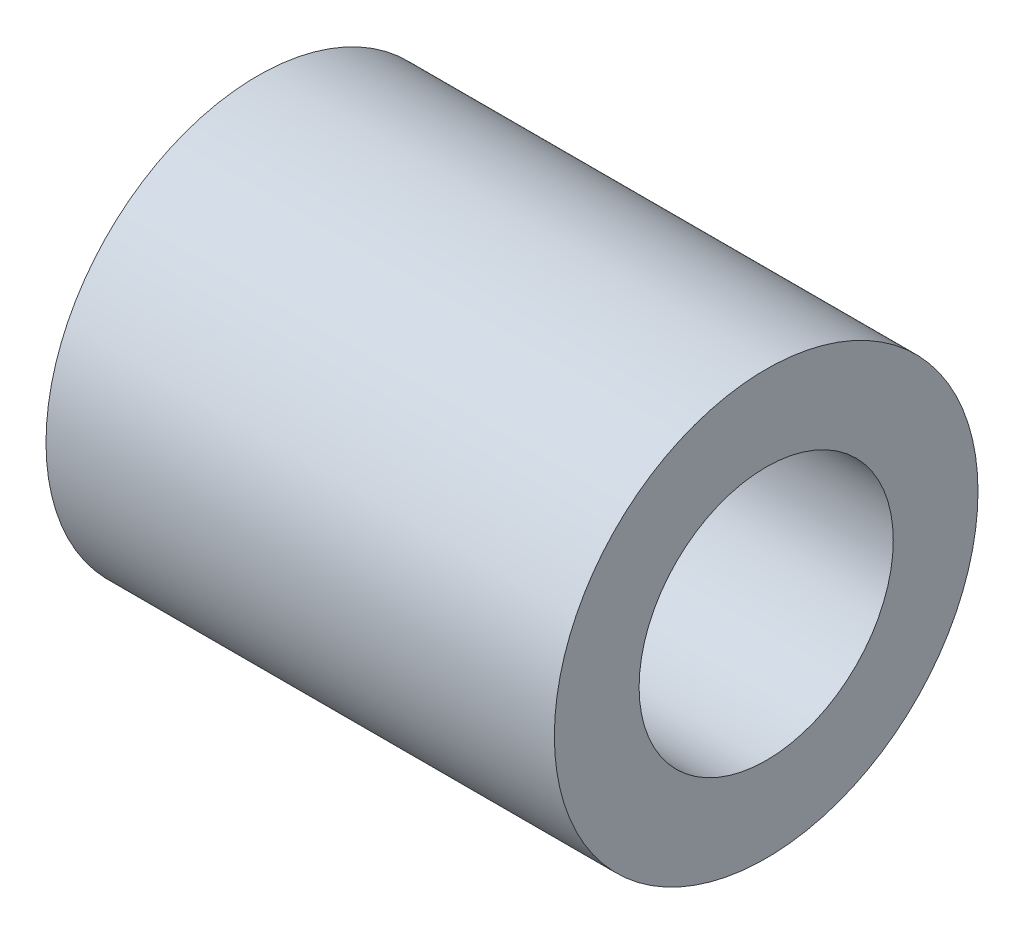
from build123d import *

# Parameters (mm, degrees)
SKETCH1_W = 12
SKETCH1_H = 2


with BuildPart() as part:
    # Sketch1 → Revolve1 (revolve)
    with BuildSketch(Plane.XY, mode=Mode.PRIVATE) as revolve1_sk:
        with Locations((6, 4)):
            Rectangle(SKETCH1_W, SKETCH1_H)
    revolve(revolve1_sk.sketch.rotate(Axis((0, 0, 0), (1, 0, 0)), 90), axis=Axis((0, 0, 0), (1, 0, 0)))


solid = part.part
